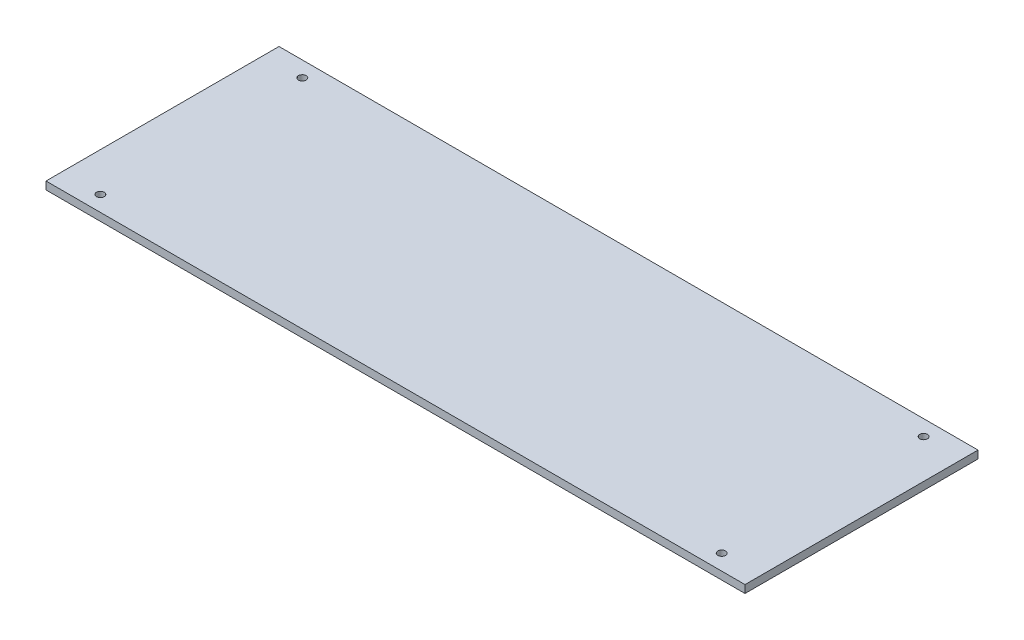
from build123d import *

# Parameters (mm, degrees)
SKETCH1_W           = 450
SKETCH1_H           = 150
BOSS_EXTRUDE1_DEPTH = 5
SKETCH2_R           = 2.5
CUT_EXTRUDE1_DEPTH  = 238.223523286


with BuildPart() as part:
    # Sketch1 → Boss-Extrude1 (new body)
    with BuildSketch(Plane(origin=(0, 0, 0), x_dir=(1, 0, 0), z_dir=(0, 1, 0))):
        Rectangle(SKETCH1_W, SKETCH1_H)
    extrude(amount=BOSS_EXTRUDE1_DEPTH)

    # Sketch2 → Cut-Extrude1 (cut, through all)
    with BuildSketch(Plane(origin=(0, 5, 0), x_dir=(1, 0, 0), z_dir=(0, 1, 0))):
        with Locations(Location((-200, 65, 0), (0, 0, 270))):
            Circle(SKETCH2_R)
        with Locations(Location((-200, -65, 0), (0, 0, 270))):
            Circle(SKETCH2_R)
        with Locations(Location((200, 65, 0), (0, 0, 270))):
            Circle(SKETCH2_R)
        with Locations(Location((200, -65, 0), (0, 0, 270))):
            Circle(SKETCH2_R)
    extrude(amount=-CUT_EXTRUDE1_DEPTH, mode=Mode.SUBTRACT)


solid = part.part
